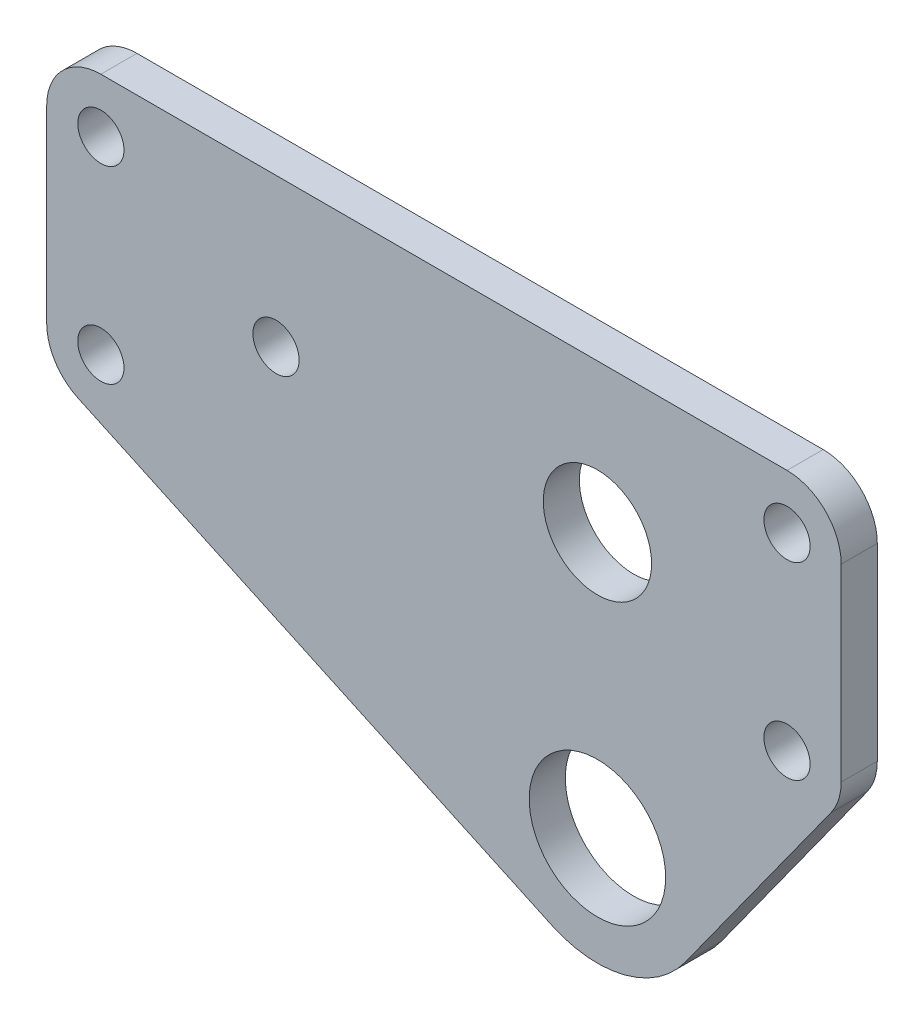
from build123d import *

# Parameters (mm, degrees)
SKETCH1_R           = 4.7625
SKETCH1_R_2         = 2.032
BOSS_EXTRUDE1_DEPTH = 3.175
BOSS_EXTRUDE2_START = -3.175
SKETCH2_R           = 6
BOSS_EXTRUDE2_DEPTH = 3.175


with BuildPart() as part:
    # Sketch1 → Boss-Extrude1 (new body)
    with BuildSketch(Plane.XY):
        with BuildLine():
            Line((43.65625, -13.0556), (-16.66875, -13.0556))
            ThreePointArc((-16.66875, -13.0556), (-20.036346045, -11.660696045), (-21.43125, -8.2931))
            Line((-21.43125, -8.2931), (-21.43125, 8.2931))
            ThreePointArc((-21.43125, 8.2931), (-20.036346045, 11.660696045), (-16.66875, 13.0556))
            Line((-16.66875, 13.0556), (43.65625, 13.0556))
            ThreePointArc((43.65625, 13.0556), (47.023846045, 11.660696045), (48.41875, 8.2931))
            Line((48.41875, 8.2931), (48.41875, -8.2931))
            ThreePointArc((48.41875, -8.2931), (47.023846045, -11.660696045), (43.65625, -13.0556))
        make_face()
        with Locations((26.9875, 0)):
            Circle(SKETCH1_R, mode=Mode.SUBTRACT)
        with Locations((-16.66875, 8.2931)):
            Circle(SKETCH1_R_2, mode=Mode.SUBTRACT)
        with Locations((43.65625, 8.2931)):
            Circle(SKETCH1_R_2, mode=Mode.SUBTRACT)
        with Locations((-16.66875, -8.2931)):
            Circle(SKETCH1_R_2, mode=Mode.SUBTRACT)
        with Locations((43.65625, -8.2931)):
            Circle(SKETCH1_R_2, mode=Mode.SUBTRACT)
        with Locations((-1.27, 0)):
            Circle(SKETCH1_R_2, mode=Mode.SUBTRACT)
    extrude(amount=BOSS_EXTRUDE1_DEPTH)

    # Sketch2 → Boss-Extrude2 (add)
    with BuildSketch(Plane.XY.offset(3.175).offset(BOSS_EXTRUDE2_START)):
        with BuildLine():
            Line((22.98118695, -31.924816254), (-18.671906525, -12.613837227))
            ThreePointArc((-18.671906525, -12.613837227), (-17.694394969, -12.943848181), (-16.66875, -13.0556))
            Line((-16.66875, -13.0556), (43.65625, -13.0556))
            ThreePointArc((43.65625, -13.0556), (45.826918249, -12.53215716), (47.520433425, -11.076891067))
            Line((47.520433425, -11.076891067), (34.71586685, -28.850923935))
            ThreePointArc((34.71586685, -28.850923935), (29.401133075, -32.49746142), (22.98118695, -31.924816254))
        make_face()
        with Locations((26.9875, -23.2833418)):
            Circle(SKETCH2_R, mode=Mode.SUBTRACT)
    extrude(amount=BOSS_EXTRUDE2_DEPTH)


solid = part.part
